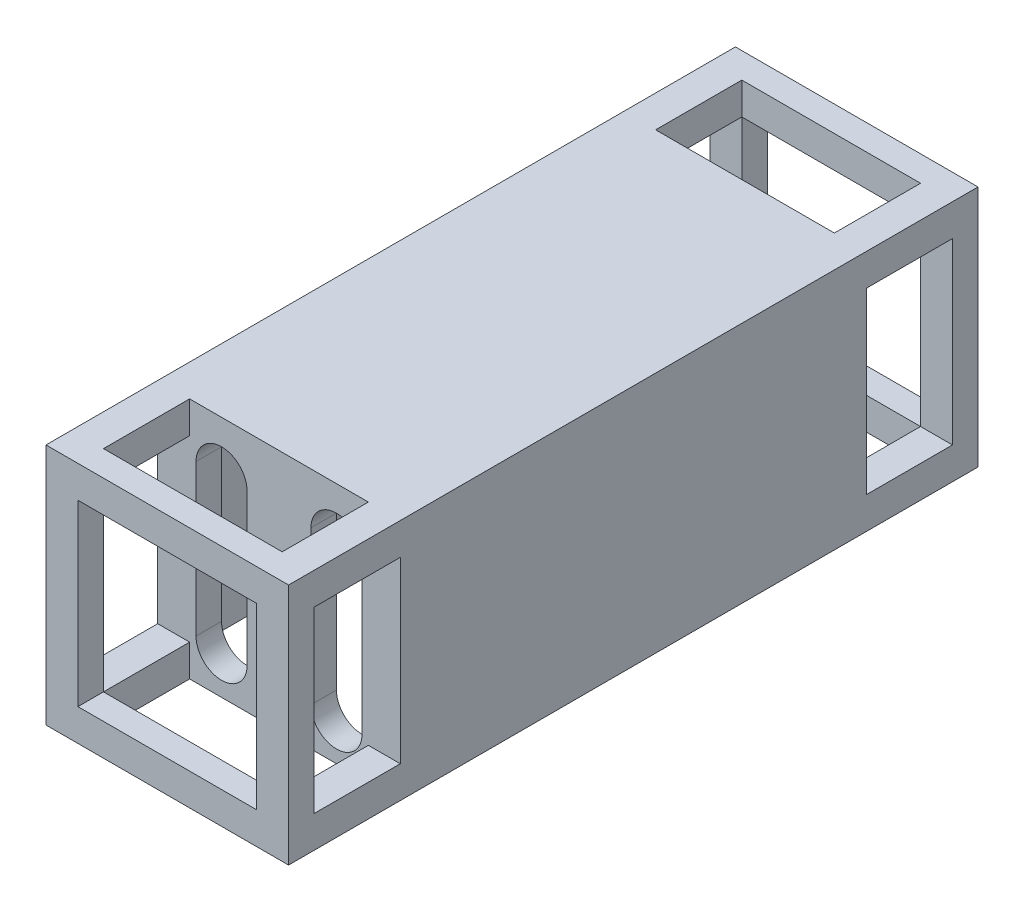
from build123d import *

# Parameters (mm, degrees)
RESSALTO_EXTRUS_O1_DEPTH = 65
ESBO_O2_W                = 38
ESBO_O2_H                = 38
RESSALTO_EXTRUS_O2_DEPTH = 4
ESBO_O4_W                = 5
ESBO_O4_H                = 5
RESSALTO_EXTRUS_O3_DEPTH = 13.5
ESBO_O5_W                = 38
ESBO_O5_H                = 38
ESBO_O5_W_2              = 28
ESBO_O5_H_2              = 28
RESSALTO_EXTRUS_O4_DEPTH = 4


with BuildPart() as part:
    # Esboço1 → Ressalto-extrusão1 (new body)
    with BuildSketch(Plane.XY):
        with BuildLine():
            Line((18, 0), (19, 0))
            Line((19, 0), (19, 38))
            Line((19, 38), (-19, 38))
            Line((-19, 38), (-19, 0))
            Line((-19, 0), (-18, 0))
            Line((-18, 0), (-18, 9))
            Line((-18, 9), (-18, 27))
            ThreePointArc((-18, 27), (-15.363961031, 33.363961031), (-9, 36))
            Line((-9, 36), (9, 36))
            ThreePointArc((9, 36), (15.363961031, 33.363961031), (18, 27))
            Line((18, 27), (18, 0))
        make_face()
    extrude(amount=RESSALTO_EXTRUS_O1_DEPTH)

    # Esboço2 → Ressalto-extrusão2 (add)
    with BuildSketch(Plane(origin=(0, 0, 0), x_dir=(-1, 0, 0), z_dir=(0, 0, -1))):
        with Locations((0, 19)):
            Rectangle(ESBO_O2_W, ESBO_O2_H)
        with BuildLine():
            Line((-5, 30), (-5, 6))
            ThreePointArc((-5, 6), (-9, 2), (-13, 6))
            Line((-13, 6), (-13, 30))
            ThreePointArc((-13, 30), (-9, 34), (-5, 30))
        make_face(mode=Mode.SUBTRACT)
        with BuildLine():
            Line((13, 30), (13, 6.321034479))
            ThreePointArc((13, 6.321034479), (9, 2.321034479), (5, 6.321034479))
            Line((5, 6.321034479), (5, 30))
            ThreePointArc((5, 30), (9, 34), (13, 30))
        make_face(mode=Mode.SUBTRACT)
    ressalto_extrus_o2 = extrude(amount=RESSALTO_EXTRUS_O2_DEPTH)

    # Esboço4 → Ressalto-extrusão3 (add)
    with BuildSketch(Plane(origin=(0, 0, -4), x_dir=(-1, 0, 0), z_dir=(0, 0, -1))):
        with Locations((16.5, 35.5)):
            Rectangle(ESBO_O4_W, ESBO_O4_H)
        with Locations((16.5, 2.5)):
            Rectangle(ESBO_O4_W, ESBO_O4_H)
        with Locations((-16.5, 35.5)):
            Rectangle(ESBO_O4_W, ESBO_O4_H)
        with Locations((-16.5, 2.5)):
            Rectangle(ESBO_O4_W, ESBO_O4_H)
    ressalto_extrus_o3 = extrude(amount=RESSALTO_EXTRUS_O3_DEPTH)

    # Esboço5 → Ressalto-extrusão4 (add)
    with BuildSketch(Plane(origin=(0, 0, -17.5), x_dir=(-1, 0, 0), z_dir=(0, 0, -1))):
        with Locations((0, 19)):
            Rectangle(ESBO_O5_W, ESBO_O5_H)
        with Locations((0, 19)):
            Rectangle(ESBO_O5_W_2, ESBO_O5_H_2, mode=Mode.SUBTRACT)
    ressalto_extrus_o4 = extrude(amount=RESSALTO_EXTRUS_O4_DEPTH)

    # Espelhar1: Ressalto-extrusão2, Ressalto-extrusão3, Ressalto-extrusão4 across plane
    add(ressalto_extrus_o2.mirror(Plane.XY.offset(32.5)))
    add(ressalto_extrus_o3.mirror(Plane.XY.offset(32.5)))
    add(ressalto_extrus_o4.mirror(Plane.XY.offset(32.5)))


solid = part.part
